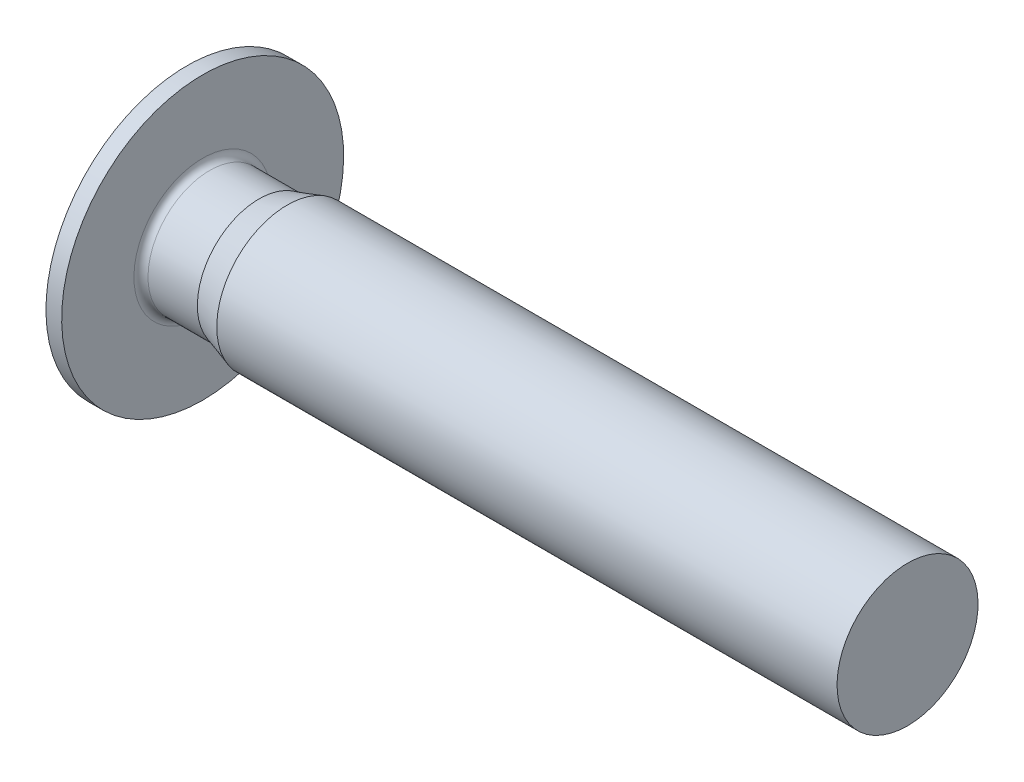
from build123d import *

# Parameters (mm, degrees)
FILLET1_R          = 0.1
CUT_EXTRUDE1_DEPTH = 1.2


with BuildPart() as part:
    # Sketch1 → Revolve1 (revolve)
    with BuildSketch(Plane.XY, mode=Mode.PRIVATE) as revolve1_sk:
        Polygon((-0.5, 0), (-0.5, 1.52), (-0.222871871, 2), (0, 2), (0, 0.875), (0.8, 0.875), (1.2, 1), (10, 1), (10, 0), align=None)
    revolve(revolve1_sk.sketch.rotate(Axis((-0.5, 0, 0), (1, 0, 0)), 180), axis=Axis((-0.5, 0, 0), (1, 0, 0)))

    # Fillet1
    fillet1_edges = [part.edges().sort_by_distance(p)[0] for p in [
        (0, 0.875, 0),
    ]]
    fillet(fillet1_edges, radius=FILLET1_R)

    # Sketch2 → Cut-Extrude1 (cut)
    with BuildSketch(Plane.ZY.offset(0.5)):
        Polygon((0, 0.75055535), (-0.65, 0.375277675), (-0.65, -0.375277675), (0, -0.75055535), (0.65, -0.375277675), (0.65, 0.375277675), align=None)
    extrude(amount=-CUT_EXTRUDE1_DEPTH, mode=Mode.SUBTRACT)

    # Sketch3 → Cut-Revolve1 (revolve, cut)
    with BuildSketch(Plane.XY, mode=Mode.PRIVATE) as cut_revolve1_sk:
        Polygon((0.7, 0), (0.7, 0.65), (1.090559402, 0), align=None)
    revolve(cut_revolve1_sk.sketch.rotate(Axis((0.7, 0, 0), (1, 0, 0)), 180), axis=Axis((0.7, 0, 0), (1, 0, 0)), mode=Mode.SUBTRACT)


solid = part.part
